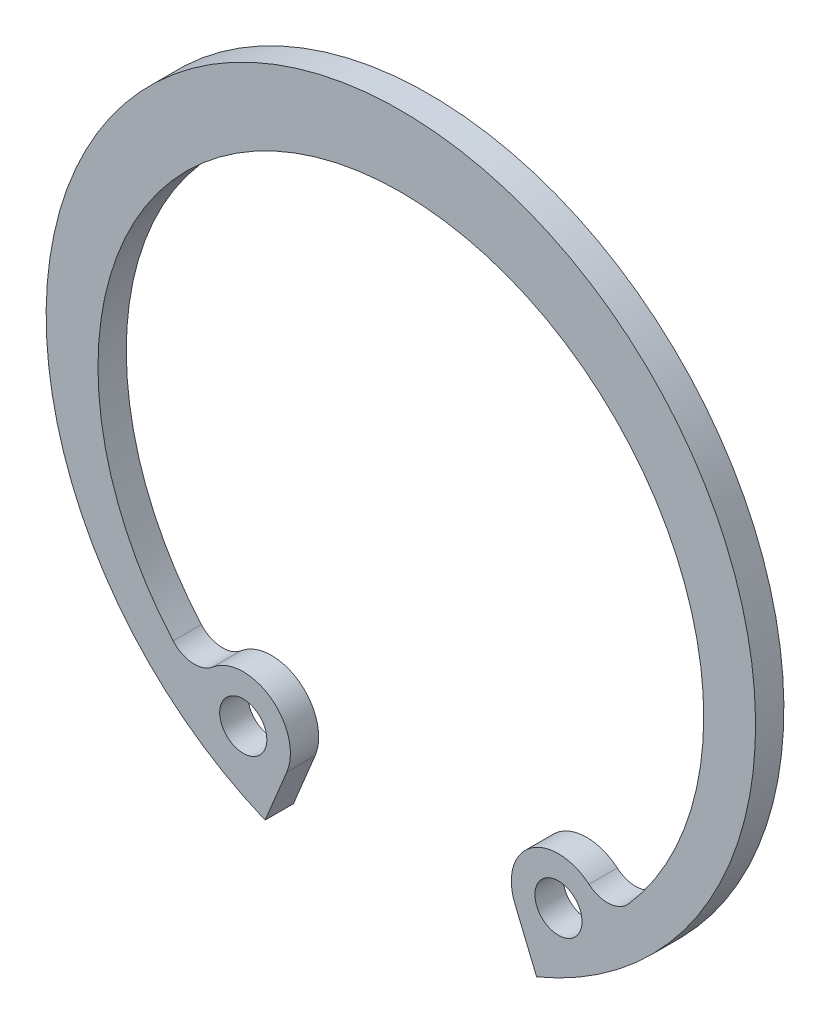
from build123d import *

# Parameters (mm, degrees)
SKETCH1_R  = 1
BODY_DEPTH = 1.2


with BuildPart() as part:
    # Sketch1 → Body (new body)
    with BuildSketch(Plane.XY):
        with BuildLine():
            Line((4.838184168, -11.680409837), (5.759385657, -13.904386964))
            ThreePointArc((5.759385657, -13.904386964), (0, 15.05), (-5.759385657, -13.904386964))
            Line((-5.759385657, -13.904386964), (-4.838184168, -11.680409837))
            ThreePointArc((-4.838184168, -11.680409837), (-5.509315283, -9.297777791), (-7.982849932, -9.392534182))
            ThreePointArc((-7.982849932, -9.392534182), (-8.84825604, -9.675851923), (-9.66341393, -9.270001843))
            ThreePointArc((-9.66341393, -9.270001843), (0, 12.05), (9.66341393, -9.270001843))
            ThreePointArc((9.66341393, -9.270001843), (8.84825604, -9.675851923), (7.982849932, -9.392534182))
            ThreePointArc((7.982849932, -9.392534182), (5.509315283, -9.297777791), (4.838184168, -11.680409837))
        make_face()
        with Locations(Location((6.685943233, -10.915042972, 0), (0, 0, 180))):
            Circle(SKETCH1_R, mode=Mode.SUBTRACT)
        with Locations((-6.685943233, -10.915042972)):
            Circle(SKETCH1_R, mode=Mode.SUBTRACT)
    extrude(amount=-BODY_DEPTH)


solid = part.part
